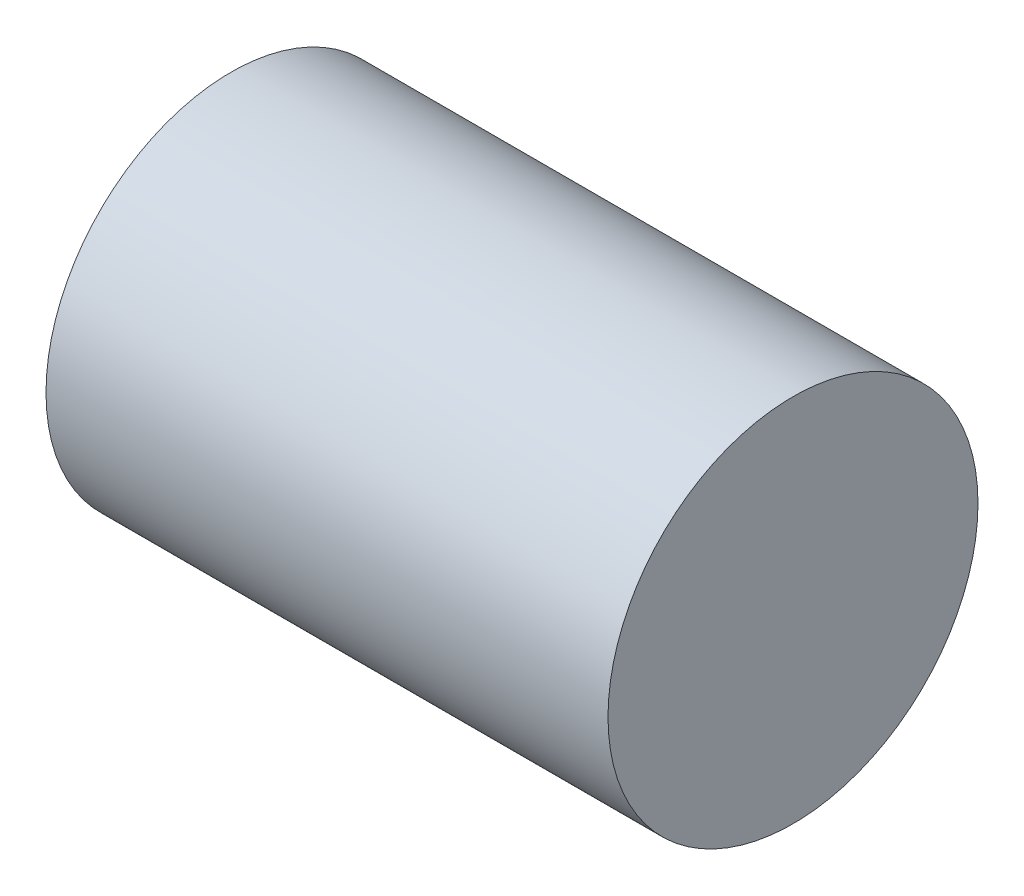
from build123d import *

# Parameters (mm, degrees)
SKETCH1_W = 71.374
SKETCH1_H = 23.495


with BuildPart() as part:
    # Sketch1 → Revolve1 (revolve)
    with BuildSketch(Plane(origin=(0, 0, 0), x_dir=(1, 0, 0), z_dir=(0, 1, 0)), mode=Mode.PRIVATE) as revolve1_sk:
        with Locations((0, 11.7475)):
            Rectangle(SKETCH1_W, SKETCH1_H)
    revolve(revolve1_sk.sketch.rotate(Axis((-74.317257732, 0, 0), (1, 0, 0)), 180), axis=Axis((-74.317257732, 0, 0), (1, 0, 0)))


solid = part.part
